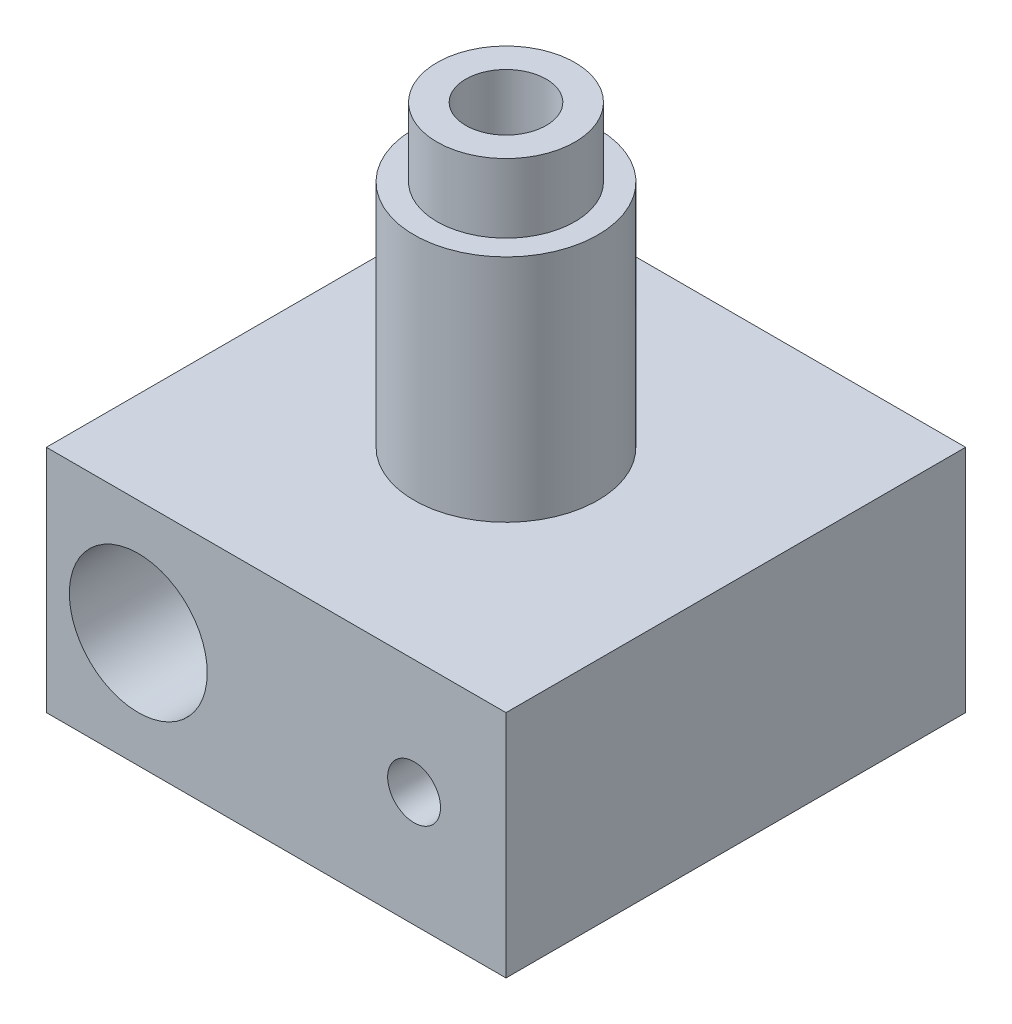
from build123d import *

# Parameters (mm, degrees)
SCHIZZO2_W                          = 20
SCHIZZO2_H                          = 20
SCHIZZO2_R                          = 0.15
ESTRUSIONE_ESTRUSIONE1_DEPTH        = 10
SCHIZZO3_R                          = 4
SCHIZZO3_R_2                        = 1.75
ESTRUSIONE_SOTTILE1_DEPTH           = 13
TAGLIO_ESTRUSIONE1_REACH            = 34.078
SCHIZZO4_R                          = 3
SCHIZZO4_R_2                        = 1.15
FORO_FILETTATO_M6X1_0_1_D           = 5
FORO_FILETTATO_M6X1_0_1_DEPTH       = 12
FORO_FILETTATO_M6X1_0_1_CSINK_D     = 6.05
FORO_FILETTATO_M6X1_0_1_CSINK_ANGLE = 90
FORO_FILETTATO_M6X1_0_1_TIP         = 1.502151548
SCHIZZO8_R                          = 13
SCHIZZO8_R_2                        = 3
TAGLIO_ESTRUSIONE_SOTTILE1_DEPTH    = 3


with BuildPart() as part:
    # Schizzo1 → Rivoluzione1 (revolve)
    with BuildSketch(Plane.XY, mode=Mode.PRIVATE) as rivoluzione1_sk:
        Polygon((-0.15, 0), (-0.15, -5), (-0.5, -5), (-3, -2), (-3, 0), align=None)
    revolve(rivoluzione1_sk.sketch.rotate(Axis((0, -26.528171736, 0), (0, 1, 0)), 270), axis=Axis((0, -26.528171736, 0), (0, 1, 0)))

    # Schizzo2 → Estrusione-Estrusione1 (add)
    with BuildSketch(Plane(origin=(0, 0, 0), x_dir=(1, 0, 0), z_dir=(0, 1, 0))):
        Rectangle(SCHIZZO2_W, SCHIZZO2_H)
        with Locations(Location((0, 0, 0), (0, 0, 90))):
            Circle(SCHIZZO2_R, mode=Mode.SUBTRACT)
    extrude(amount=ESTRUSIONE_ESTRUSIONE1_DEPTH)

    # Schizzo3 → Estrusione-Sottile1 (add)
    with BuildSketch(Plane(origin=(0, 10, 0), x_dir=(1, 0, 0), z_dir=(0, 1, 0))):
        Circle(SCHIZZO3_R)
        Circle(SCHIZZO3_R_2, mode=Mode.SUBTRACT)
    extrude(amount=ESTRUSIONE_SOTTILE1_DEPTH)

    # Schizzo4 → Taglio-Estrusione1 (cut, up to next)
    with BuildSketch(Plane.XY.offset(10), mode=Mode.PRIVATE) as taglio_estrusione1_sk1:
        with Locations((-6, 5)):
            Circle(SCHIZZO4_R)
    taglio_estrusione1_tool1 = extrude(taglio_estrusione1_sk1.sketch, amount=-TAGLIO_ESTRUSIONE1_REACH, mode=Mode.PRIVATE) & part.part
    # Schizzo4 → Taglio-Estrusione1 (cut, up to next)
    with BuildSketch(Plane.XY.offset(10), mode=Mode.PRIVATE) as taglio_estrusione1_sk2:
        with Locations((6, 5)):
            Circle(SCHIZZO4_R_2)
    taglio_estrusione1_tool2 = extrude(taglio_estrusione1_sk2.sketch, amount=-TAGLIO_ESTRUSIONE1_REACH, mode=Mode.PRIVATE) & part.part
    add(taglio_estrusione1_tool1.solids().sort_by_distance((-6, 5, 10))[0], mode=Mode.SUBTRACT)
    add(taglio_estrusione1_tool2.solids().sort_by_distance((6, 5, 10))[0], mode=Mode.SUBTRACT)

    # Foro filettato M6x1.0-1
    with Locations(Plane(origin=(0, 0, -10), x_dir=(-1, 0, 0), z_dir=(0, 0, -1))):
        with Locations((-6, 5)):
            CounterSinkHole(FORO_FILETTATO_M6X1_0_1_D / 2, FORO_FILETTATO_M6X1_0_1_CSINK_D / 2, depth=FORO_FILETTATO_M6X1_0_1_DEPTH, counter_sink_angle=FORO_FILETTATO_M6X1_0_1_CSINK_ANGLE)
            with Locations((0, 0, -(FORO_FILETTATO_M6X1_0_1_DEPTH + FORO_FILETTATO_M6X1_0_1_TIP / 2))):  # 118° drill point
                Cone(0, FORO_FILETTATO_M6X1_0_1_D / 2, FORO_FILETTATO_M6X1_0_1_TIP, mode=Mode.SUBTRACT)

    # Schizzo8 → Taglio-Estrusione-Sottile1 (cut)
    with BuildSketch(Plane(origin=(0, 23, 0), x_dir=(1, 0, 0), z_dir=(0, 1, 0))):
        Circle(SCHIZZO8_R)
        Circle(SCHIZZO8_R_2, mode=Mode.SUBTRACT)
    extrude(amount=-TAGLIO_ESTRUSIONE_SOTTILE1_DEPTH, mode=Mode.SUBTRACT)


solid = part.part
